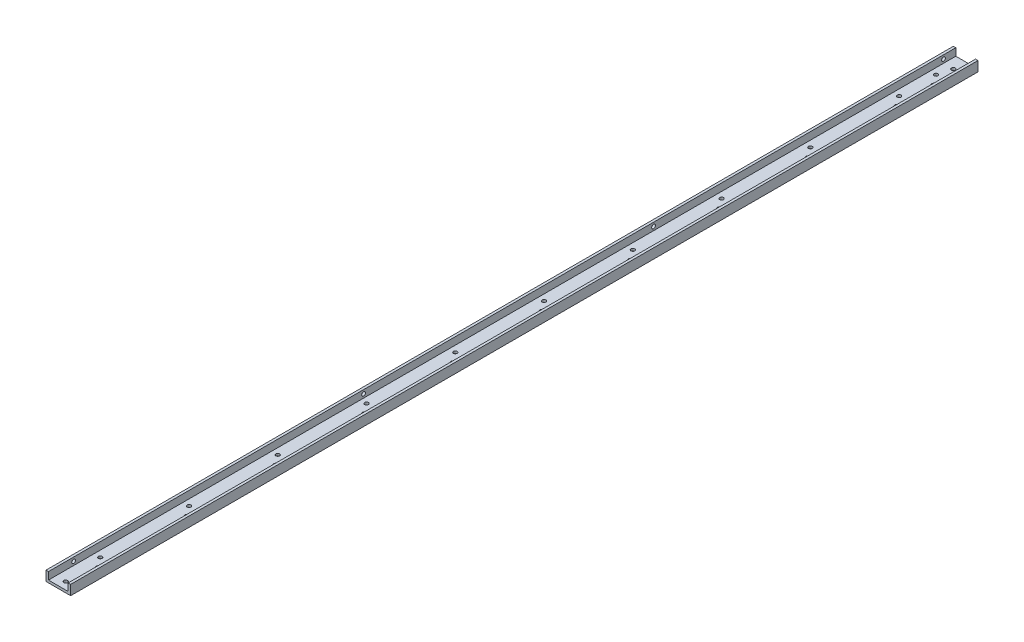
from build123d import *

# Parameters (mm, degrees)
BOSS_EXTRUDE1_DEPTH = 1168.4
CUT_EXTRUDE1_REACH  = 1170.87
SKETCH3_R           = 2.413
CUT_EXTRUDE2_REACH  = 1170.87
SKETCH4_R           = 2.413
LPATTERN1_COUNT     = 10
LPATTERN1_PITCH     = 114.3
CUT_EXTRUDE3_REACH  = 1170.9
SKETCH5_R           = 2.413
CUT_EXTRUDE4_REACH  = 1170.9
SKETCH6_R           = 2.413
CUT_EXTRUDE5_REACH  = 1170.87
SKETCH7_R           = 2.413


with BuildPart() as part:
    # Sketch1 → Boss-Extrude1 (new body)
    with BuildSketch(Plane.XY):
        Polygon((3.175, 3.175), (3.175, 12.7), (0, 12.7), (0, 0), (31.75, 0), (31.75, 12.7), (28.575, 12.7), (28.575, 3.175), align=None)
    extrude(amount=BOSS_EXTRUDE1_DEPTH)

    # Sketch3 → Cut-Extrude1 (cut, up to next)
    with BuildSketch(Plane(origin=(0, 3.175, 0), x_dir=(1, 0, 0), z_dir=(0, 1, 0)), mode=Mode.PRIVATE) as cut_extrude1_sk1:
        with Locations(Location((11.1125, -1109.6625, 0), (0, 0, 270))):
            Circle(SKETCH3_R)
    cut_extrude1_tool1 = extrude(cut_extrude1_sk1.sketch, amount=-CUT_EXTRUDE1_REACH, mode=Mode.PRIVATE) & part.part
    # Sketch3 → Cut-Extrude1 (cut, up to next)
    with BuildSketch(Plane(origin=(0, 3.175, 0), x_dir=(1, 0, 0), z_dir=(0, 1, 0)), mode=Mode.PRIVATE) as cut_extrude1_sk2:
        with Locations(Location((20.6375, -1122.3625, 0), (0, 0, 270))):
            Circle(SKETCH3_R)
    cut_extrude1_tool2 = extrude(cut_extrude1_sk2.sketch, amount=-CUT_EXTRUDE1_REACH, mode=Mode.PRIVATE) & part.part
    cut_extrude1_1 = cut_extrude1_tool1.solids().sort_by_distance((11.1125, 3.175, 1109.6625))[0]
    add(cut_extrude1_1, mode=Mode.SUBTRACT)
    cut_extrude1_2 = cut_extrude1_tool2.solids().sort_by_distance((20.6375, 3.175, 1122.3625))[0]
    add(cut_extrude1_2, mode=Mode.SUBTRACT)
    cut_extrude1 = cut_extrude1_1 + cut_extrude1_2  # Cut-Extrude1 as one shape, for the pattern or mirror that repeats it

    # Sketch4 → Cut-Extrude2 (cut, up to next)
    with BuildSketch(Plane(origin=(0, 3.175, 0), x_dir=(1, 0, 0), z_dir=(0, 1, 0)), mode=Mode.PRIVATE) as cut_extrude2_sk1:
        with Locations(Location((15.875, -1158.875, 0), (0, 0, 270))):
            Circle(SKETCH4_R)
    cut_extrude2_tool1 = extrude(cut_extrude2_sk1.sketch, amount=-CUT_EXTRUDE2_REACH, mode=Mode.PRIVATE) & part.part
    add(cut_extrude2_tool1.solids().sort_by_distance((15.875, 3.175, 1158.875))[0], mode=Mode.SUBTRACT)

    # LPattern1: Cut-Extrude1 ×10
    with Locations(*[(0, 0, -i * LPATTERN1_PITCH) for i in range(1, LPATTERN1_COUNT)]):
        add(cut_extrude1, mode=Mode.SUBTRACT)

    # Sketch5 → Cut-Extrude3 (cut, up to next)
    with BuildSketch(Plane.ZY, mode=Mode.PRIVATE) as cut_extrude3_sk1:
        with Locations((15.875, 7.9375)):
            Circle(SKETCH5_R)
    cut_extrude3_tool1 = extrude(cut_extrude3_sk1.sketch, amount=-CUT_EXTRUDE3_REACH, mode=Mode.PRIVATE) & part.part
    # Sketch5 → Cut-Extrude3 (cut, up to next)
    with BuildSketch(Plane.ZY, mode=Mode.PRIVATE) as cut_extrude3_sk2:
        with Locations((389.255, 7.9375)):
            Circle(SKETCH5_R)
    cut_extrude3_tool2 = extrude(cut_extrude3_sk2.sketch, amount=-CUT_EXTRUDE3_REACH, mode=Mode.PRIVATE) & part.part
    # Sketch5 → Cut-Extrude3 (cut, up to next)
    with BuildSketch(Plane.ZY, mode=Mode.PRIVATE) as cut_extrude3_sk3:
        with Locations((762.635, 7.9375)):
            Circle(SKETCH5_R)
    cut_extrude3_tool3 = extrude(cut_extrude3_sk3.sketch, amount=-CUT_EXTRUDE3_REACH, mode=Mode.PRIVATE) & part.part
    # Sketch5 → Cut-Extrude3 (cut, up to next)
    with BuildSketch(Plane.ZY, mode=Mode.PRIVATE) as cut_extrude3_sk4:
        with Locations((1136.015, 7.9375)):
            Circle(SKETCH5_R)
    cut_extrude3_tool4 = extrude(cut_extrude3_sk4.sketch, amount=-CUT_EXTRUDE3_REACH, mode=Mode.PRIVATE) & part.part
    add(cut_extrude3_tool1.solids().sort_by_distance((0, 7.9375, 15.875))[0], mode=Mode.SUBTRACT)
    add(cut_extrude3_tool2.solids().sort_by_distance((0, 7.9375, 389.255))[0], mode=Mode.SUBTRACT)
    add(cut_extrude3_tool3.solids().sort_by_distance((0, 7.9375, 762.635))[0], mode=Mode.SUBTRACT)
    add(cut_extrude3_tool4.solids().sort_by_distance((0, 7.9375, 1136.015))[0], mode=Mode.SUBTRACT)

    # Sketch6 → Cut-Extrude4 (cut, up to next)
    with BuildSketch(Plane.XZ, mode=Mode.PRIVATE) as cut_extrude4_sk1:
        with Locations(Location((11.1125, 33.3375, 0), (0, 0, 270))):
            Circle(SKETCH6_R)
    cut_extrude4_tool1 = extrude(cut_extrude4_sk1.sketch, amount=-CUT_EXTRUDE4_REACH, mode=Mode.PRIVATE) & part.part
    # Sketch6 → Cut-Extrude4 (cut, up to next)
    with BuildSketch(Plane.XZ, mode=Mode.PRIVATE) as cut_extrude4_sk2:
        with Locations(Location((20.6375, 46.0375, 0), (0, 0, 270))):
            Circle(SKETCH6_R)
    cut_extrude4_tool2 = extrude(cut_extrude4_sk2.sketch, amount=-CUT_EXTRUDE4_REACH, mode=Mode.PRIVATE) & part.part
    add(cut_extrude4_tool1.solids().sort_by_distance((11.1125, 0, 33.3375))[0], mode=Mode.SUBTRACT)
    add(cut_extrude4_tool2.solids().sort_by_distance((20.6375, 0, 46.0375))[0], mode=Mode.SUBTRACT)

    # Sketch7 → Cut-Extrude5 (cut, up to next)
    with BuildSketch(Plane(origin=(0, 3.175, 0), x_dir=(1, 0, 0), z_dir=(0, 1, 0)), mode=Mode.PRIVATE) as cut_extrude5_sk1:
        with Locations(Location((15.875, -15.875, 0), (0, 0, 270))):
            Circle(SKETCH7_R)
    cut_extrude5_tool1 = extrude(cut_extrude5_sk1.sketch, amount=-CUT_EXTRUDE5_REACH, mode=Mode.PRIVATE) & part.part
    add(cut_extrude5_tool1.solids().sort_by_distance((15.875, 3.175, 15.875))[0], mode=Mode.SUBTRACT)


solid = part.part
